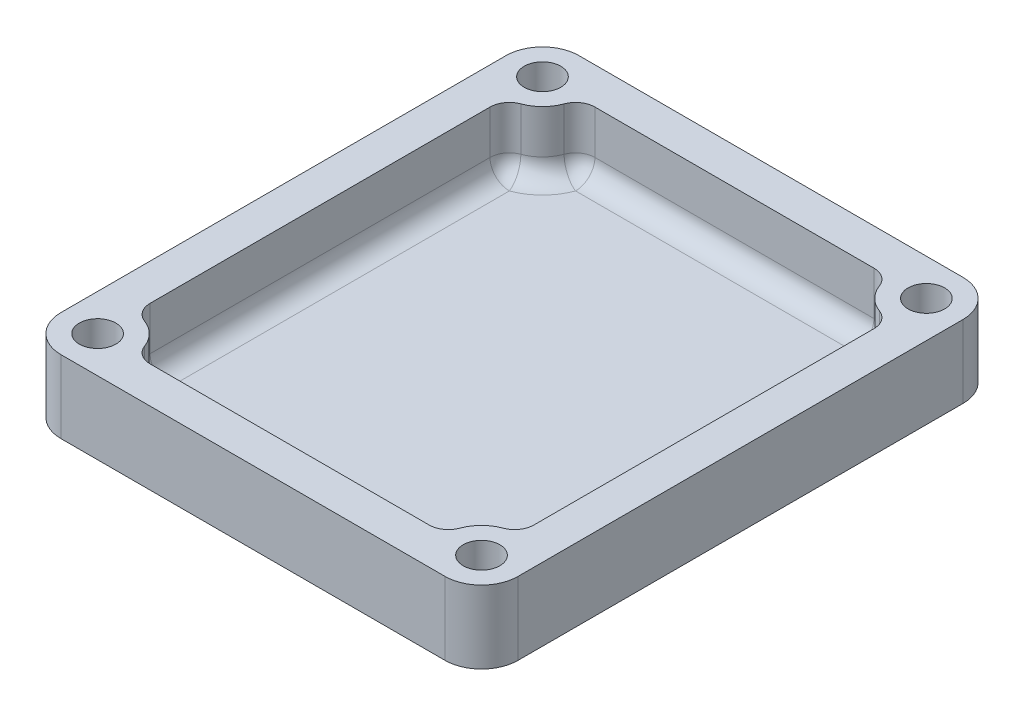
from build123d import *

# Parameters (mm, degrees)
SKETCH1_R               = 3
BOSS_EXTRUDE1_DEPTH     = 11.938
CUT_EXTRUDE1_DEPTH      = 58.922498599
CUT_EXTRUDE1_DEPTH_BACK = 10.3378
FILLET1_R               = 3.175


with BuildPart() as part:
    # Sketch1 → Boss-Extrude1 (new body)
    with BuildSketch(Plane(origin=(0, 0, 0), x_dir=(1, 0, 0), z_dir=(0, 1, 0))):
        with BuildLine():
            Line((-31.5, -42.5), (31.5, -42.5))
            ThreePointArc((31.5, -42.5), (35.742640687, -40.742640687), (37.5, -36.5))
            Line((37.5, -36.5), (37.5, 36.5))
            ThreePointArc((37.5, 36.5), (35.742640687, 40.742640687), (31.5, 42.5))
            Line((31.5, 42.5), (-31.5, 42.5))
            ThreePointArc((-31.5, 42.5), (-35.742640687, 40.742640687), (-37.5, 36.5))
            Line((-37.5, 36.5), (-37.5, -36.5))
            ThreePointArc((-37.5, -36.5), (-35.742640687, -40.742640687), (-31.5, -42.5))
        make_face()
        with Locations(Location((-31.5, 36.5, 0), (0, 0, 270))):
            Circle(SKETCH1_R, mode=Mode.SUBTRACT)
        with Locations(Location((-31.5, -36.5, 0), (0, 0, 270))):
            Circle(SKETCH1_R, mode=Mode.SUBTRACT)
        with Locations(Location((31.5, -36.5, 0), (0, 0, 270))):
            Circle(SKETCH1_R, mode=Mode.SUBTRACT)
        with Locations(Location((31.5, 36.5, 0), (0, 0, 270))):
            Circle(SKETCH1_R, mode=Mode.SUBTRACT)
    extrude(amount=-BOSS_EXTRUDE1_DEPTH)

    # Sketch2 → Cut-Extrude1 (cut, two sides: drawn at the far end of the back side and taken through both)
    with BuildSketch(Plane(origin=(0, 0, 0), x_dir=(1, 0, 0), z_dir=(0, 1, 0)).offset(-CUT_EXTRUDE1_DEPTH_BACK)):
        with BuildLine():
            Line((-22.891864313, -36.5), (22.891864313, -36.5))
            ThreePointArc((22.891864313, -36.5), (24.707385496, -35.929708781), (25.870701458, -34.423705722))
            ThreePointArc((25.870701458, -34.423705722), (27.257359313, -32.257359313), (29.423705722, -30.870701458))
            ThreePointArc((29.423705722, -30.870701458), (30.929708781, -29.707385496), (31.5, -27.891864313))
            Line((31.5, -27.891864313), (31.5, 27.891864313))
            ThreePointArc((31.5, 27.891864313), (30.929708781, 29.707385496), (29.423705722, 30.870701458))
            ThreePointArc((29.423705722, 30.870701458), (27.257359313, 32.257359313), (25.870701458, 34.423705722))
            ThreePointArc((25.870701458, 34.423705722), (24.707385496, 35.929708781), (22.891864313, 36.5))
            Line((22.891864313, 36.5), (-22.891864313, 36.5))
            ThreePointArc((-22.891864313, 36.5), (-24.707385496, 35.929708781), (-25.870701458, 34.423705722))
            ThreePointArc((-25.870701458, 34.423705722), (-27.257359313, 32.257359313), (-29.423705722, 30.870701458))
            ThreePointArc((-29.423705722, 30.870701458), (-30.929708781, 29.707385496), (-31.5, 27.891864313))
            Line((-31.5, 27.891864313), (-31.5, -27.891864313))
            ThreePointArc((-31.5, -27.891864313), (-30.929708781, -29.707385496), (-29.423705722, -30.870701458))
            ThreePointArc((-29.423705722, -30.870701458), (-27.257359313, -32.257359313), (-25.870701458, -34.423705722))
            ThreePointArc((-25.870701458, -34.423705722), (-24.707385496, -35.929708781), (-22.891864313, -36.5))
        make_face()
    extrude(amount=CUT_EXTRUDE1_DEPTH + CUT_EXTRUDE1_DEPTH_BACK, mode=Mode.SUBTRACT)

    # Fillet1
    fillet1_edges = [part.edges().sort_by_distance(p)[0] for p in [
        (24.707385496, -10.3378, -35.929708781),
        (27.257359313, -10.3378, -32.257359313),
        (30.929708781, -10.3378, -29.707385496),
        (31.5, -10.3378, 0),
        (30.929708781, -10.3378, 29.707385496),
        (27.257359313, -10.3378, 32.257359313),
        (24.707385496, -10.3378, 35.929708781),
        (0, -10.3378, 36.5),
        (-24.707385496, -10.3378, 35.929708781),
        (-27.257359313, -10.3378, 32.257359313),
        (-30.929708781, -10.3378, 29.707385496),
        (-31.5, -10.3378, 0),
        (-30.929708781, -10.3378, -29.707385496),
        (-27.257359313, -10.3378, -32.257359313),
        (-24.707385496, -10.3378, -35.929708781),
        (0, -10.3378, -36.5),
    ]]
    fillet(fillet1_edges, radius=FILLET1_R)


solid = part.part
